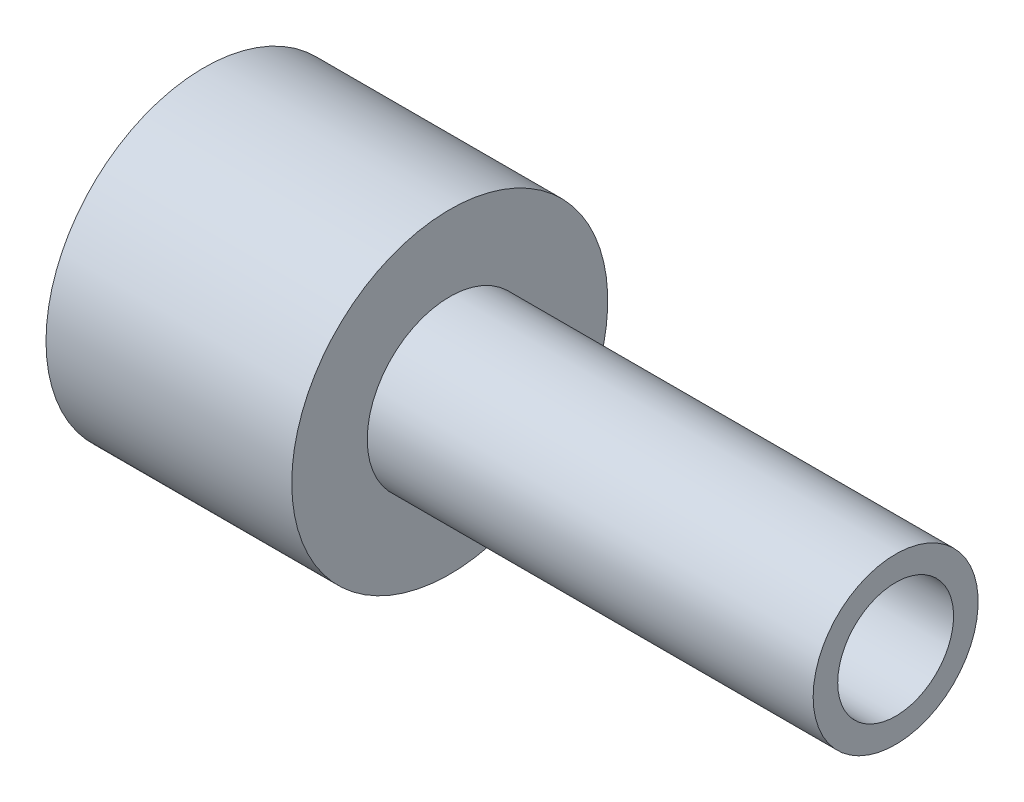
from build123d import *


with BuildPart() as part:
    # Axial profile (mm) → Full revolution (revolve)
    with BuildSketch(Plane.XY, mode=Mode.PRIVATE) as full_revolution_sk:
        Polygon((-6, 1.65), (13.7, 1.65), (13.7, 2.35), (1, 2.35), (1, 4.5), (-6, 4.5), align=None)
    revolve(full_revolution_sk.sketch.rotate(Axis((-110, 0, 0), (1, 0, 0)), 90), axis=Axis((-110, 0, 0), (1, 0, 0)))


solid = part.part
